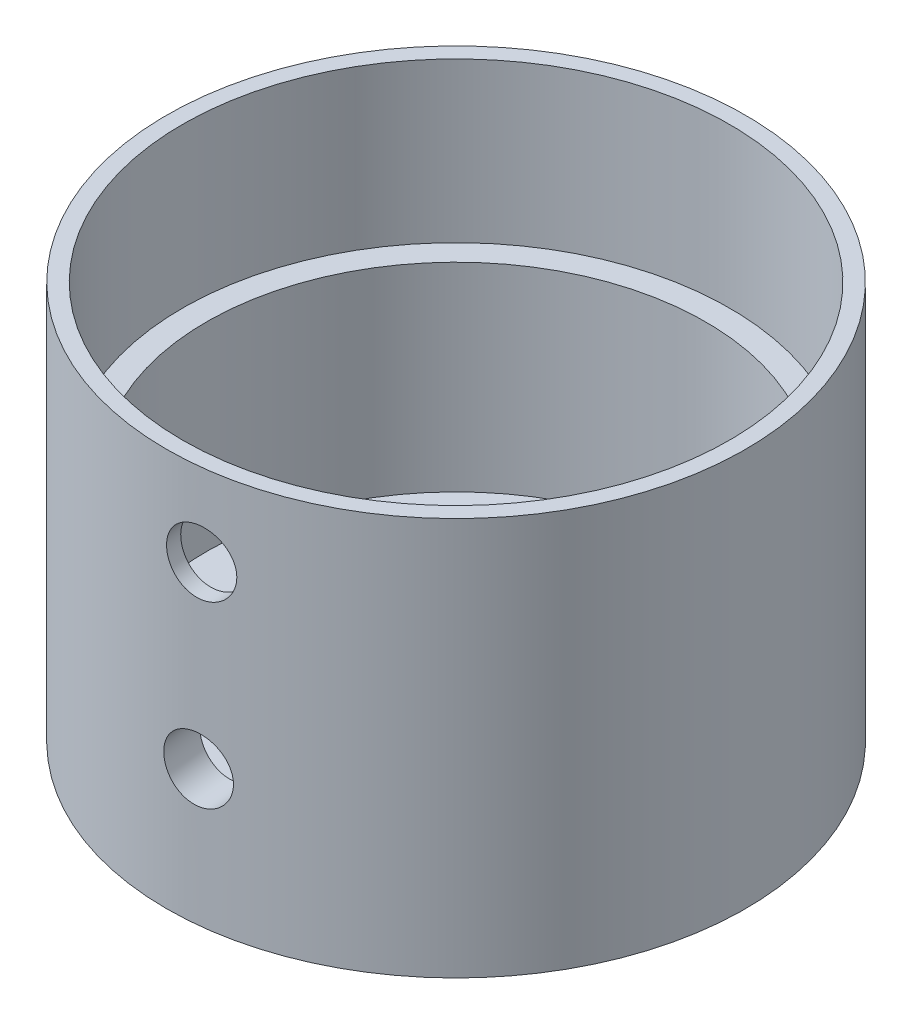
from build123d import *

# Parameters (mm, degrees)
SKETCH_6_R                 = 72.75
EXTRUDE_16_DEPTH           = 100
SHELL_8_T                  = -10
CUT_EXTRUDE_START          = -40
SKETCH_13_R                = 68.75
SKETCH_13_R_2              = 62.75
CUT_EXTRUDE_5_DEPTH        = 40
F_16_0MM_2_REACH           = 180.442
F_16_0MM_2_BORE_R          = 8
F_16_0MM_2_ON_FACE_2_REACH = 185.929
F_16_0MM_2_BORE_2_R        = 8


with BuildPart() as part:
    # 草圖6 → 填料-伸長16 (new body)
    with BuildSketch(Plane(origin=(0, 0, 0), x_dir=(1, 0, 0), z_dir=(0, 1, 0))):
        with Locations(Location((0, 0, 0), (0, 0, 270))):
            Circle(SKETCH_6_R)
    extrude(amount=EXTRUDE_16_DEPTH)

    # 薄殼8
    shell_8_openings = [part.faces().sort_by_distance(p)[0] for p in [
        (0, 100, 0),
    ]]
    offset(amount=SHELL_8_T, openings=shell_8_openings, kind=Kind.INTERSECTION)

    # 草圖13 → 除料-伸長5 (cut)
    with BuildSketch(Plane(origin=(0, 100, 0), x_dir=(1, 0, 0), z_dir=(0, 1, 0)).offset(CUT_EXTRUDE_START)):
        with Locations(Location((0, 0, 0), (0, 0, 270))):
            Circle(SKETCH_13_R)
        with Locations(Location((0, 0, 0), (0, 0, 270))):
            Circle(SKETCH_13_R_2, mode=Mode.SUBTRACT)
    extrude(amount=CUT_EXTRUDE_5_DEPTH, mode=Mode.SUBTRACT)

    # Ø16.0mm 定位孔2 bore (on position points) → Ø16.0mm 定位孔2 (cut, up to next)
    with BuildSketch(Plane(origin=(7.281311378, 33.875955165, 72.384701454), x_dir=(0.994978714148, 0, -0.100086754332), z_dir=(0.100086754332, 0, 0.994978714148)), mode=Mode.PRIVATE) as f_16_0mm_2_sk1:
        Circle(F_16_0MM_2_BORE_R)
    f_16_0mm_2_tool1 = extrude(f_16_0mm_2_sk1.sketch, amount=-F_16_0MM_2_REACH, mode=Mode.PRIVATE) & part.part
    add(f_16_0mm_2_tool1.solids().sort_by_distance((7.281311, 33.875955, 72.384701))[0], mode=Mode.SUBTRACT)

    # Ø16.0mm 定位孔2 bore 2 (on position points) → Ø16.0mm 定位孔2 on face 2 (cut, up to next)
    with BuildSketch(Plane(origin=(7.98509872, 79.17918137, 72.310446676), x_dir=(0.993958008506, 0, -0.109761000939), z_dir=(0.109761000939, 0, 0.993958008506)), mode=Mode.PRIVATE) as f_16_0mm_2_on_face_2_sk1:
        Circle(F_16_0MM_2_BORE_2_R)
    f_16_0mm_2_on_face_2_tool1 = extrude(f_16_0mm_2_on_face_2_sk1.sketch, amount=-F_16_0MM_2_ON_FACE_2_REACH, mode=Mode.PRIVATE) & part.part
    add(f_16_0mm_2_on_face_2_tool1.solids().sort_by_distance((7.985099, 79.179181, 72.310447))[0], mode=Mode.SUBTRACT)


solid = part.part
